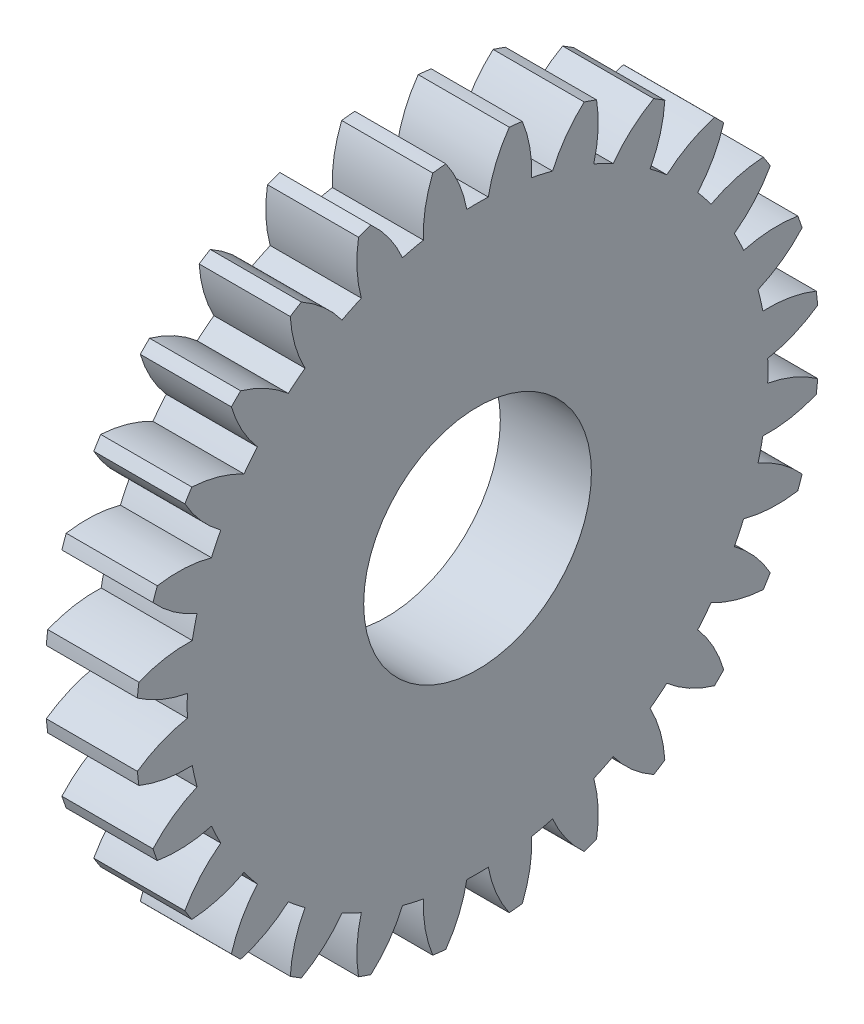
from build123d import *

# Parameters (mm, degrees)
BASPROSKE_W     = 4
BASPROSKE_H     = 15
TOOTHCUT_DEPTH  = 22.587033145
TEETHCUTS_COUNT = 28
TEETHCUTS_ANGLE = 347.142857143
BORSKE_R        = 5
BORE_DEPTH      = 50.0000508


with BuildPart() as part:
    # BasProSke → Base-Revolve (revolve)
    with BuildSketch(Plane(origin=(0, 0, 0), x_dir=(1, 0, 0), z_dir=(0, 1, 0)), mode=Mode.PRIVATE) as base_revolve_sk:
        with Locations((2, 7.5)):
            Rectangle(BASPROSKE_W, BASPROSKE_H)
    revolve(base_revolve_sk.sketch.rotate(Axis((-10, 0, 0), (1, 0, 0)), 180), axis=Axis((-10, 0, 0), (1, 0, 0)))

    # TooCutSke → ToothCut (cut, through all)
    with BuildSketch(Plane(origin=(0, 0, 0), x_dir=(0, 0, -1), z_dir=(1, 0, 0))):
        with BuildLine():
            ThreePointArc((0.471336039, 12.740284272), (0, 12.749), (-0.471336039, 12.740284272))
            ThreePointArc((-0.471336039, 12.740284272), (-0.81983923, 13.900763331), (-1.409805137, 14.959114099))
            ThreePointArc((-1.409805137, 14.959114099), (0, 15.0254), (1.409805137, 14.959114099))
            ThreePointArc((1.409805137, 14.959114099), (0.81983923, 13.900763331), (0.471336039, 12.740284272))
        make_face()
    toothcut = extrude(amount=TOOTHCUT_DEPTH, mode=Mode.SUBTRACT)

    # TeethCuts: ToothCut ×28 about axis
    teethcuts_axis = Axis((-10, 0, 0), (1, 0, 0))
    for i in range(1, TEETHCUTS_COUNT):
        add(toothcut.rotate(teethcuts_axis, i * TEETHCUTS_ANGLE / (TEETHCUTS_COUNT - 1)), mode=Mode.SUBTRACT)

    # BorSke → Bore (cut, symmetric)
    with BuildSketch(Plane(origin=(0, 0, 0), x_dir=(0, 0, -1), z_dir=(1, 0, 0))):
        with Locations(Location((0, 0, 0), (0, 0, 180))):
            Circle(BORSKE_R)
    extrude(amount=BORE_DEPTH, both=True, mode=Mode.SUBTRACT)


solid = part.part
